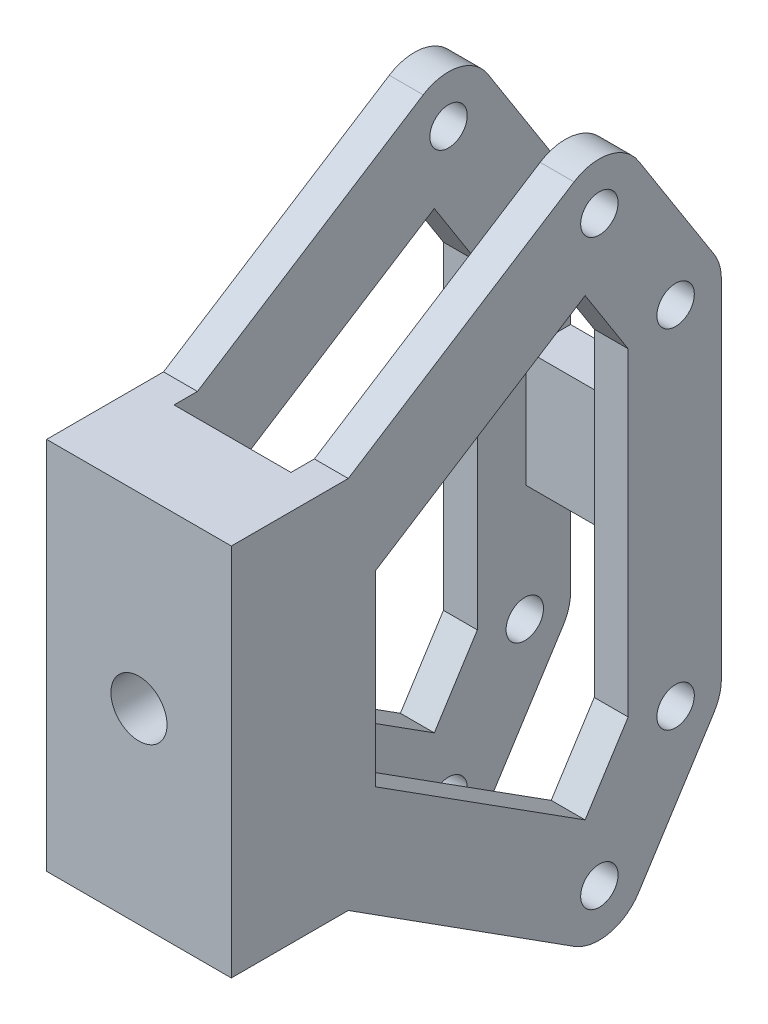
from build123d import *

# Parameters (mm, degrees)
SKETCH1_R               = 4
BOSS_EXTRUDE1_DEPTH     = 39.5
CUT_EXTRUDE1_DEPTH      = 105.5
CUT_EXTRUDE1_DEPTH_BACK = 117.5
SKETCH2_W               = 25
SKETCH2_H               = 75.25
CUT_EXTRUDE2_DEPTH      = 43.5
SKETCH4_R               = 6
CUT_EXTRUDE3_DEPTH      = 41
SCALE1_SCALE            = 0.7


with BuildPart() as part:
    # Sketch1 → Boss-Extrude1 (new body)
    with BuildSketch(Plane(origin=(0, 0, 0), x_dir=(0, 0, -1), z_dir=(1, 0, 0))):
        with BuildLine():
            Line((0, -40), (0, 40))
            Line((0, 40), (25, 40))
            Line((25, 40), (73.280107592, 70.785366831))
            ThreePointArc((73.280107592, 70.785366831), (80.81695996, 72.117470486), (87.088258906, 67.730050596))
            Line((87.088258906, 67.730050596), (103.222887942, 42.426417539))
            ThreePointArc((103.222887942, 42.426417539), (104.391084837, 39.850237691), (104.791154167, 37.05))
            Line((104.791154167, 37.05), (104.791154167, -37.05))
            ThreePointArc((104.791154167, -37.05), (104.391084837, -39.850237691), (103.222887942, -42.426417539))
            Line((103.222887942, -42.426417539), (87.088258906, -67.730050596))
            ThreePointArc((87.088258906, -67.730050596), (80.81695996, -72.117470486), (73.280107592, -70.785366831))
            Line((73.280107592, -70.785366831), (25, -40))
            Line((25, -40), (0, -40))
        make_face()
        with Locations((78.7, 62.25)):
            Circle(SKETCH1_R, mode=Mode.SUBTRACT)
        with Locations((95, 37.153633057)):
            Circle(SKETCH1_R, mode=Mode.SUBTRACT)
        with Locations(Location((95, -37.153633057, 0), (0, 0, 180))):
            Circle(SKETCH1_R, mode=Mode.SUBTRACT)
        with Locations(Location((78.7, -62.25, 0), (0, 0, 180))):
            Circle(SKETCH1_R, mode=Mode.SUBTRACT)
        Polygon((30.81, -20), (30.81, 20), (75.651092334, 48.552793879), (84.857166207, 34.095), (84.857166207, -34.095), (75.651092334, -48.552793879), align=None, mode=Mode.SUBTRACT)
    extrude(amount=BOSS_EXTRUDE1_DEPTH)

    # Sketch2 → Cut-Extrude1 (cut, two sides: drawn at the far end of the back side and taken through both)
    with BuildSketch(Plane(origin=(0, 0, 0), x_dir=(1, 0, 0), z_dir=(0, 1, 0)).offset(-CUT_EXTRUDE1_DEPTH_BACK)):
        with Locations((19.75, 57.625)):
            Rectangle(SKETCH2_W, SKETCH2_H)
    extrude(amount=CUT_EXTRUDE1_DEPTH + CUT_EXTRUDE1_DEPTH_BACK, mode=Mode.SUBTRACT)

    # Sketch3 → Cut-Extrude2 (cut)
    with BuildSketch(Plane(origin=(0, 0, -104.791154167), x_dir=(-1, 0, 0), z_dir=(0, 0, -1))):
        Polygon((-7.25, -37.05), (-7.25, -12.5), (-32.25, -12.5), (-32.25, -37.05), (-32.25, -54.930146657), (-7.25, -54.930146657), align=None)
        Polygon((-32.25, 37.05), (-32.25, 12.5), (-7.25, 12.5), (-7.25, 37.05), (-7.25, 54.930146657), (-32.25, 54.930146657), align=None)
    extrude(amount=-CUT_EXTRUDE2_DEPTH, mode=Mode.SUBTRACT)

    # Sketch4 → Cut-Extrude3 (cut)
    with BuildSketch(Plane.XY):
        with Locations((19.75, 0)):
            Circle(SKETCH4_R)
    extrude(amount=-CUT_EXTRUDE3_DEPTH, mode=Mode.SUBTRACT)


with BuildPart() as part_1:
    # Scale1: scaled about (19.75, 0, -44.562080974)
    add(part.part.scale(SCALE1_SCALE).moved(Location((5.925, 0, -13.368624292))))


solid = part_1.part
